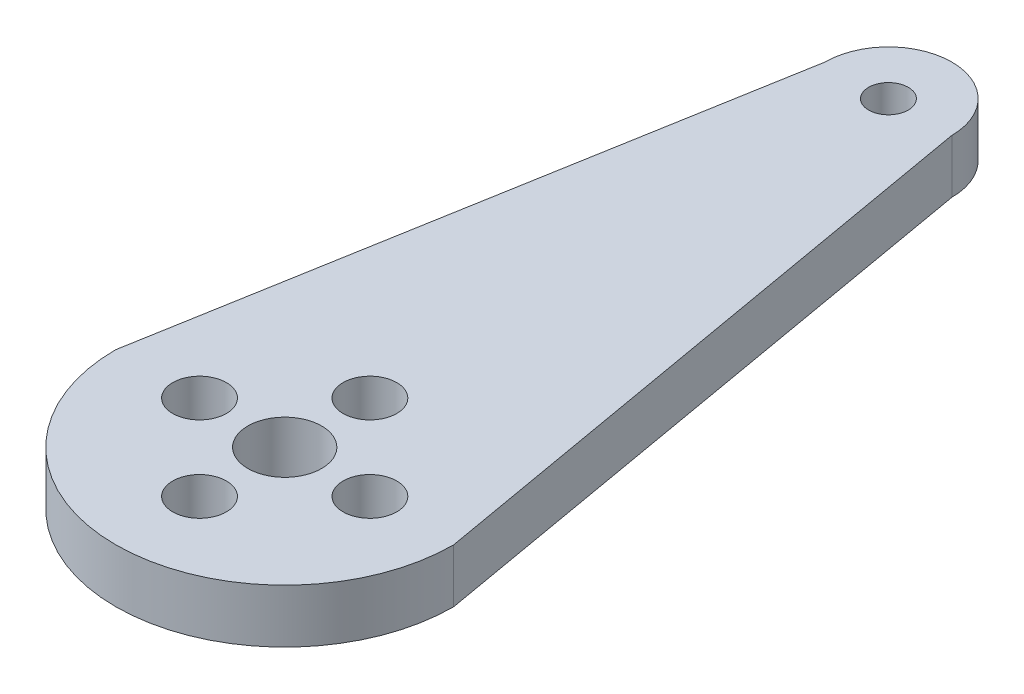
from build123d import *

# Parameters (mm, degrees)
SKETCH1_R           = 4.729578235
SKETCH1_R_2         = 1.475
SKETCH1_R_3         = 2
SKETCH1_R_4         = 2.75
BOSS_EXTRUDE1_DEPTH = 4


with BuildPart() as part:
    # Sketch1 → Boss-Extrude1 (new body)
    # profile 1 of 3: a face of its own
    with BuildSketch(Plane(origin=(0, 0, 0), x_dir=(1, 0, 0), z_dir=(0, 1, 0))):
        with Locations((0, 45)):
            Circle(SKETCH1_R)
        with Locations(Location((0, 45, 0), (0, 0, 270))):
            Circle(SKETCH1_R_2, mode=Mode.SUBTRACT)
    # profile 2 of 3: a face of its own
    with BuildSketch(Plane(origin=(0, 0, 0), x_dir=(1, 0, 0), z_dir=(0, 1, 0))):
        with BuildLine():
            Line((11.849111677, 4.273338853), (4.729578235, 45))
            ThreePointArc((4.729578235, 45), (0, 40.270421765), (-4.729578235, 45))
            Line((-4.729578235, 45), (-11.849111677, 4.273338853))
            ThreePointArc((-11.849111677, 4.273338853), (0, 12.596145144), (11.849111677, 4.273338853))
        make_face()
    # profile 3 of 3: a face of its own
    with BuildSketch(Plane(origin=(0, 0, 0), x_dir=(1, 0, 0), z_dir=(0, 1, 0))):
        with BuildLine():
            Line((12.596145144, 0), (11.849111677, 4.273338853))
            ThreePointArc((11.849111677, 4.273338853), (0, 12.596145144), (-11.849111677, 4.273338853))
            Line((-11.849111677, 4.273338853), (-12.596145144, 0))
            ThreePointArc((-12.596145144, 0), (0, -12.596145144), (12.596145144, 0))
        make_face()
        with Locations(Location((-6.35, 0, 0), (0, 0, 270))):
            Circle(SKETCH1_R_3, mode=Mode.SUBTRACT)
        with Locations(Location((0, -6.35, 0), (0, 0, 270))):
            Circle(SKETCH1_R_3, mode=Mode.SUBTRACT)
        with Locations(Location((0, 0, 0), (0, 0, 270))):
            Circle(SKETCH1_R_4, mode=Mode.SUBTRACT)
        with Locations(Location((6.35, 0, 0), (0, 0, 270))):
            Circle(SKETCH1_R_3, mode=Mode.SUBTRACT)
        with Locations(Location((0, 6.35, 0), (0, 0, 270))):
            Circle(SKETCH1_R_3, mode=Mode.SUBTRACT)
    extrude(amount=BOSS_EXTRUDE1_DEPTH)


solid = part.part
